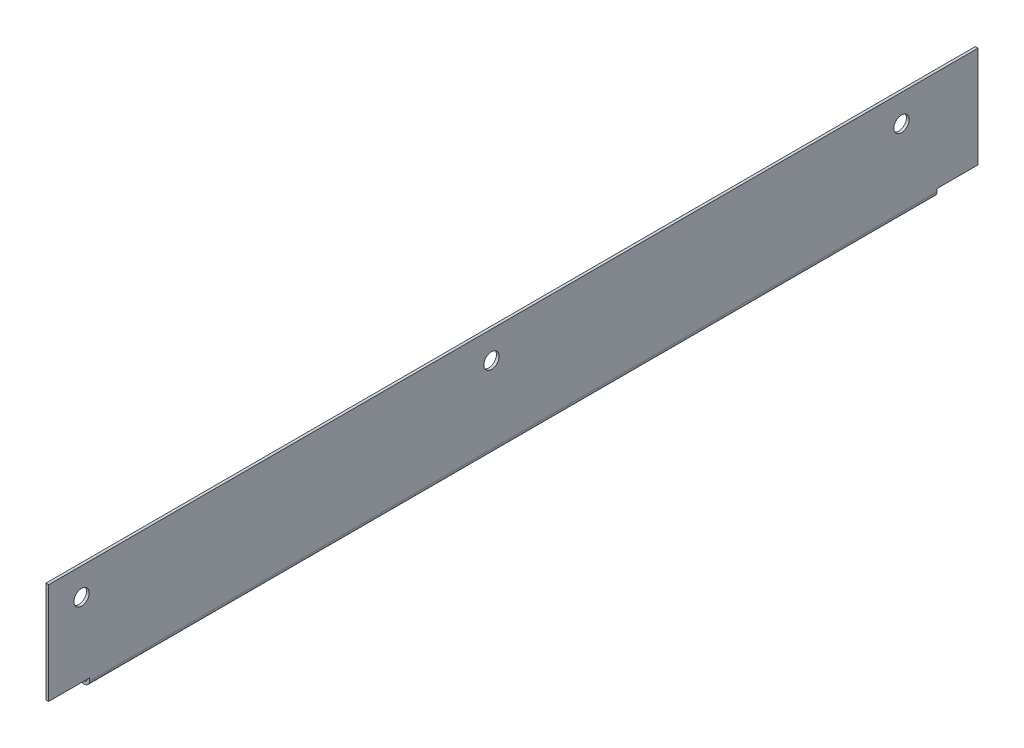
from build123d import *

# Parameters (mm, degrees)
EXTRUDE_1_DEPTH     = 340
SKETCH_2_R          = 2.8
CUT_EXTRUDE_1_DEPTH = 340
SKETCH_3_R          = 2.15
CUT_EXTRUDE_2_DEPTH = 340
SKETCH_4_W          = 37.623292197
SKETCH_4_H          = 20.655925128
SKETCH_4_W_2        = 42.547460075
SKETCH_4_H_2        = 15
SKETCH_4_W_3        = 34.50961452
CUT_EXTRUDE_3_DEPTH = 3


with BuildPart() as part:
    # Эскиз1 → Вытянуть1 (new body)
    with BuildSketch(Plane.XY):
        with BuildLine():
            Line((-2, 0), (-15, 0))
            Line((-15, 0), (-15, 1))
            Line((-15, 1), (-2, 1))
            ThreePointArc((-2, 1), (-1.292893219, 1.292893219), (-1, 2))
            Line((-1, 2), (-1, 40))
            Line((-1, 40), (0, 40))
            Line((0, 40), (0, 2))
            ThreePointArc((0, 2), (-0.585786438, 0.585786438), (-2, 0))
        make_face()
    extrude(amount=-EXTRUDE_1_DEPTH)

    # Эскиз2 → Вырез-Вытянуть1 (cut)
    with BuildSketch(Plane(origin=(0, 0, 0), x_dir=(0, 0, -1), z_dir=(1, 0, 0))):
        with Locations((12, 30)):
            Circle(SKETCH_2_R)
        with Locations((162, 30)):
            Circle(SKETCH_2_R)
        with Locations((312, 30)):
            Circle(SKETCH_2_R)
    extrude(amount=-CUT_EXTRUDE_1_DEPTH, mode=Mode.SUBTRACT)

    # Эскиз3 → Вырез-Вытянуть2 (cut)
    with BuildSketch(Plane.XZ):
        with Locations((-9, -240)):
            Circle(SKETCH_3_R)
        with Locations((-9, -170)):
            Circle(SKETCH_3_R)
        with Locations((-9, -100)):
            Circle(SKETCH_3_R)
        with Locations((-9, -30)):
            Circle(SKETCH_3_R)
    extrude(amount=-CUT_EXTRUDE_2_DEPTH, mode=Mode.SUBTRACT)

    # Эскиз4 → Вырез-Вытянуть3 (cut)
    with BuildSketch(Plane.XZ):
        with Locations((6.462024168, 335.327962564)):
            Rectangle(SKETCH_4_W, SKETCH_4_H)
        with Locations((3.999940229, -7.5)):
            Rectangle(SKETCH_4_W_2, SKETCH_4_H_2)
        with Locations((2.25480726, -332.5)):
            Rectangle(SKETCH_4_W_3, SKETCH_4_H_2)
    extrude(amount=-CUT_EXTRUDE_3_DEPTH, mode=Mode.SUBTRACT)


solid = part.part
